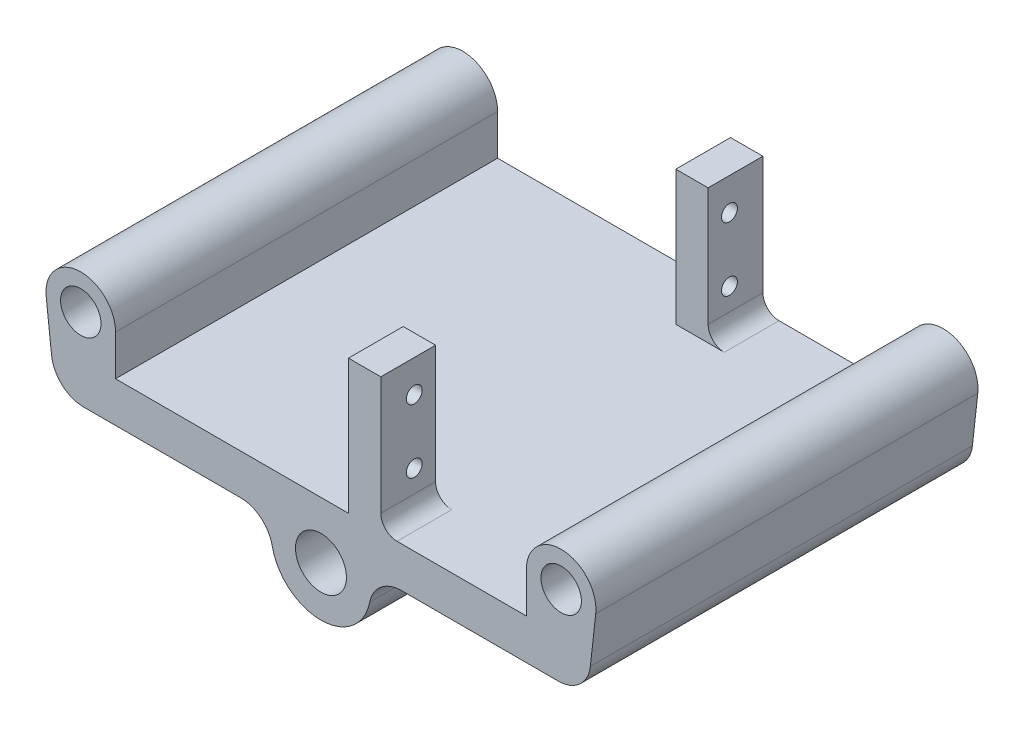
from build123d import *

# Parameters (mm, degrees)
SKETCH1_R           = 3.175
BOSS_EXTRUDE1_DEPTH = 60
SKETCH2_R           = 4
CUT_EXTRUDE1_DEPTH  = 77.120524965
BOSS_EXTRUDE2_DEPTH = 60
SKETCH5_W           = 5.08
SKETCH5_H           = 8.6
BOSS_EXTRUDE3_DEPTH = 21.1
CUT_EXTRUDE2_REACH  = 86.368
SKETCH6_R           = 1.25
FILLET1_R           = 2.54
FILLET3_R           = 5.08
FILLET4_R           = 5.08


with BuildPart() as part:
    # Sketch1 → Boss-Extrude1 (new body)
    with BuildSketch(Plane.XY):
        with BuildLine():
            Line((0, 0), (41.801331845, 0))
            Line((41.801331845, 0), (43.146541753, 12.096417759))
            ThreePointArc((43.146541753, 12.096417759), (38.021254436, 18.152629022), (32.258, 12.7))
            Line((32.258, 12.7), (32.258, 6.35))
            Line((32.258, 6.35), (0, 6.35))
            Line((0, 6.35), (0, 0))
        make_face()
        with Locations((37.719, 12.7)):
            Circle(SKETCH1_R, mode=Mode.SUBTRACT)
    boss_extrude1 = extrude(amount=BOSS_EXTRUDE1_DEPTH)

    # Sketch2 → Cut-Extrude1 (cut, through all)
    with BuildSketch(Plane(origin=(0, 0, 0), x_dir=(-1, 0, 0), z_dir=(0, 0, -1))):
        with Locations((0, -2.54)):
            Circle(SKETCH2_R)
    cut_extrude1 = extrude(amount=-CUT_EXTRUDE1_DEPTH, mode=Mode.SUBTRACT)

    # Sketch3 → Boss-Extrude2 (add)
    with BuildSketch(Plane(origin=(0, 0, 0), x_dir=(-1, 0, 0), z_dir=(0, 0, -1))):
        with BuildLine():
            Line((-7.385424835, 0), (-3.090048543, 0))
            ThreePointArc((-3.090048543, 0), (-3.616628264, -4.248800749), (0, -6.54))
            Line((0, -6.54), (0, -10.35))
            ThreePointArc((0, -10.35), (-6.357416928, -7.076446847), (-7.385424835, 0))
        make_face()
    boss_extrude2 = extrude(amount=-BOSS_EXTRUDE2_DEPTH)

    # Mirror1: Boss-Extrude1, Cut-Extrude1, Boss-Extrude2 across plane
    add(boss_extrude1.mirror(Plane(origin=(0, 0, 0), x_dir=(0, 0, 1), z_dir=(1, 0, 0))))
    add(cut_extrude1.mirror(Plane(origin=(0, 0, 0), x_dir=(0, 0, 1), z_dir=(1, 0, 0))), mode=Mode.SUBTRACT)
    add(boss_extrude2.mirror(Plane(origin=(0, 0, 0), x_dir=(0, 0, 1), z_dir=(1, 0, 0))))

    # Sketch5 → Boss-Extrude3 (add)
    with BuildSketch(Plane(origin=(0, 6.35, 0), x_dir=(1, 0, 0), z_dir=(0, 1, 0))):
        with Locations((6.858, -4.3)):
            Rectangle(SKETCH5_W, SKETCH5_H)
        with Locations((6.858, -55.7)):
            Rectangle(SKETCH5_W, SKETCH5_H)
    extrude(amount=BOSS_EXTRUDE3_DEPTH)

    # Sketch6 → Cut-Extrude2 (cut, up to next)
    with BuildSketch(Plane(origin=(9.398, 0, 0), x_dir=(0, 0, -1), z_dir=(1, 0, 0)), mode=Mode.PRIVATE) as cut_extrude2_sk1:
        with Locations((-54.75, 22.4)):
            Circle(SKETCH6_R)
    cut_extrude2_tool1 = extrude(cut_extrude2_sk1.sketch, amount=-CUT_EXTRUDE2_REACH, mode=Mode.PRIVATE) & part.part
    # Sketch6 → Cut-Extrude2 (cut, up to next)
    with BuildSketch(Plane(origin=(9.398, 0, 0), x_dir=(0, 0, -1), z_dir=(1, 0, 0)), mode=Mode.PRIVATE) as cut_extrude2_sk2:
        with Locations((-5.25, 22.4)):
            Circle(SKETCH6_R)
    cut_extrude2_tool2 = extrude(cut_extrude2_sk2.sketch, amount=-CUT_EXTRUDE2_REACH, mode=Mode.PRIVATE) & part.part
    # Sketch6 → Cut-Extrude2 (cut, up to next)
    with BuildSketch(Plane(origin=(9.398, 0, 0), x_dir=(0, 0, -1), z_dir=(1, 0, 0)), mode=Mode.PRIVATE) as cut_extrude2_sk3:
        with Locations((-5.25, 12.4)):
            Circle(SKETCH6_R)
    cut_extrude2_tool3 = extrude(cut_extrude2_sk3.sketch, amount=-CUT_EXTRUDE2_REACH, mode=Mode.PRIVATE) & part.part
    # Sketch6 → Cut-Extrude2 (cut, up to next)
    with BuildSketch(Plane(origin=(9.398, 0, 0), x_dir=(0, 0, -1), z_dir=(1, 0, 0)), mode=Mode.PRIVATE) as cut_extrude2_sk4:
        with Locations((-54.75, 12.4)):
            Circle(SKETCH6_R)
    cut_extrude2_tool4 = extrude(cut_extrude2_sk4.sketch, amount=-CUT_EXTRUDE2_REACH, mode=Mode.PRIVATE) & part.part
    add(cut_extrude2_tool1.solids().sort_by_distance((9.398, 22.4, 54.75))[0], mode=Mode.SUBTRACT)
    add(cut_extrude2_tool2.solids().sort_by_distance((9.398, 22.4, 5.25))[0], mode=Mode.SUBTRACT)
    add(cut_extrude2_tool3.solids().sort_by_distance((9.398, 12.4, 5.25))[0], mode=Mode.SUBTRACT)
    add(cut_extrude2_tool4.solids().sort_by_distance((9.398, 12.4, 54.75))[0], mode=Mode.SUBTRACT)

    # Fillet1
    fillet1_edges = [part.edges().sort_by_distance(p)[0] for p in [
        (9.398, 6.35, 55.7),
        (9.398, 6.35, 4.3),
    ]]
    fillet(fillet1_edges, radius=FILLET1_R)

    # Fillet3
    fillet3_edges = [part.edges().sort_by_distance(p)[0] for p in [
        (7.385424835, 0, 30),
        (-7.385424835, 0, 30),
    ]]
    fillet(fillet3_edges, radius=FILLET3_R)

    # Fillet4
    fillet4_edges = [part.edges().sort_by_distance(p)[0] for p in [
        (41.801331845, 0, 30),
        (-41.801331845, 0, 30),
    ]]
    fillet(fillet4_edges, radius=FILLET4_R)


solid = part.part
